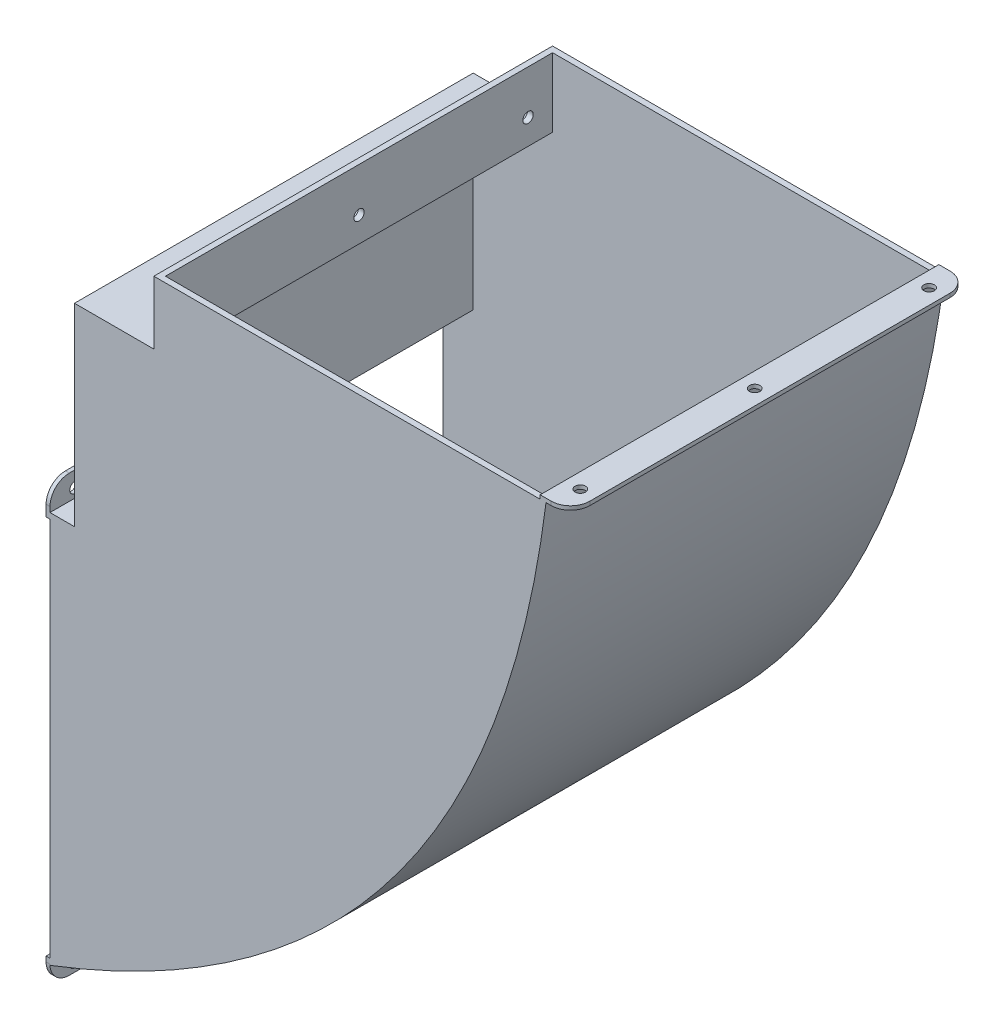
from build123d import *

# Parameters (mm, degrees)
BOSS_EXTRUDE3_DEPTH = 206.587093
SHELL1_T            = -3
BOSS_EXTRUDE4_DEPTH = 2
BOSS_EXTRUDE5_DEPTH = 2
SKETCH8_R           = 2.7
CUT_EXTRUDE2_DEPTH  = 3
SKETCH9_R           = 2.7
CUT_EXTRUDE3_DEPTH  = 2
SKETCH11_R          = 2.7
CUT_EXTRUDE4_DEPTH  = 2


with BuildPart() as part:
    # Sketch1 → Boss-Extrude3 (new body)
    with BuildSketch(Plane.XY):
        with BuildLine():
            Line((244.319092767, 234.634840909), (41.119092767, 234.634840909))
            Line((41.119092767, 234.634840909), (41.119092767, 201.934840909))
            Line((41.119092767, 201.934840909), (0, 201.934840909))
            Line((0, 201.934840909), (0, 101.672858907))
            Line((0, 101.672858907), (-12.7, 101.672858907))
            Line((-12.7, 101.672858907), (-12.7, -101.527141093))
            add(Edge.make_bspline(
                [(-12.7, -101.527141093), (212.797902698, -15.185130796), (244.319092767, 234.634840909)],
                knots=[0, 0, 0, 1, 1, 1], degree=2))
        make_face()
    extrude(amount=BOSS_EXTRUDE3_DEPTH)

    # Shell1
    shell1_openings = [part.faces().sort_by_distance(p)[0] for p in [
        (142.719092767, 234.634840909, 103.2935465),
        (-12.7, 0.072858907, 103.2935465),
    ]]
    offset(amount=SHELL1_T, openings=shell1_openings, kind=Kind.INTERSECTION)

    # Sketch4 → Boss-Extrude4 (add)
    with BuildSketch(Plane(origin=(0, 234.634840909, 0), x_dir=(1, 0, 0), z_dir=(0, 1, 0))):
        with BuildLine():
            Line((257.019092767, -10), (257.019092767, -196.587092864))
            ThreePointArc((257.019092767, -196.587092864), (254.090160579, -203.658160676), (247.019092767, -206.587092864))
            Line((247.019092767, -206.587092864), (244.319092767, -206.587092864))
            Line((244.319092767, -206.587092864), (241.295184716, -206.587092864))
            Line((241.295184716, -206.587092864), (241.295184716, 0))
            Line((241.295184716, 0), (247.019092767, 0))
            ThreePointArc((247.019092767, 0), (254.090160579, -2.928932188), (257.019092767, -10))
        make_face()
    extrude(amount=BOSS_EXTRUDE4_DEPTH)

    # Sketch5 → Boss-Extrude5 (add)
    with BuildSketch(Plane.ZY.offset(12.7)):
        with BuildLine():
            Line((10, 114.372858907), (196.587092864, 114.372858907))
            ThreePointArc((196.587092864, 114.372858907), (203.658160676, 111.443926719), (206.587092864, 104.372858907))
            Line((206.587092864, 104.372858907), (206.587092864, 98.672858907))
            Line((206.587092864, 98.672858907), (0, 98.672858907))
            Line((0, 98.672858907), (0, 104.372858907))
            ThreePointArc((0, 104.372858907), (2.928932188, 111.443926719), (10, 114.372858907))
        make_face()
        with BuildLine():
            Line((0, -98.313391167), (0, -101.013391167))
            ThreePointArc((0, -101.013391167), (2.928932188, -108.084458979), (10, -111.013391167))
            Line((10, -111.013391167), (196.587092864, -111.013391167))
            ThreePointArc((196.587092864, -111.013391167), (203.658160676, -108.084458979), (206.587092864, -101.013391167))
            Line((206.587092864, -101.013391167), (206.587092864, -98.313391167))
            Line((206.587092864, -98.313391167), (0, -98.313391167))
        make_face()
    extrude(amount=BOSS_EXTRUDE5_DEPTH)

    # Sketch8 → Cut-Extrude2 (cut)
    with BuildSketch(Plane(origin=(44.119092767, 0, 0), x_dir=(0, 0, -1), z_dir=(1, 0, 0))):
        with Locations(Location((-190.887092864, 211.934840909, 0), (0, 0, 90))):
            Circle(SKETCH8_R)
        with Locations(Location((-103.293546432, 211.934840909, 0), (0, 0, 90))):
            Circle(SKETCH8_R)
        with Locations(Location((-15.7, 211.934840909, 0), (0, 0, 90))):
            Circle(SKETCH8_R)
    extrude(amount=-CUT_EXTRUDE2_DEPTH, mode=Mode.SUBTRACT)

    # Sketch9 → Cut-Extrude3 (cut)
    with BuildSketch(Plane(origin=(0, 236.634840909, 0), x_dir=(1, 0, 0), z_dir=(0, 1, 0))):
        with Locations(Location((249.157138742, -12.931235523, 0), (0, 0, 180))):
            Circle(SKETCH9_R)
        with Locations(Location((249.157138742, -103.293546432, 0), (0, 0, 180))):
            Circle(SKETCH9_R)
        with Locations(Location((249.157138742, -193.655857341, 0), (0, 0, 180))):
            Circle(SKETCH9_R)
    extrude(amount=-CUT_EXTRUDE3_DEPTH, mode=Mode.SUBTRACT)

    # Sketch11 → Cut-Extrude4 (cut)
    with BuildSketch(Plane.ZY.offset(14.7)):
        with Locations(Location((12.933859514, 106.522858907, 0), (0, 0, 270))):
            Circle(SKETCH11_R)
        with Locations(Location((103.293546432, 106.522858907, 0), (0, 0, 270))):
            Circle(SKETCH11_R)
        with Locations(Location((193.653233351, 106.522858907, 0), (0, 0, 270))):
            Circle(SKETCH11_R)
        with Locations(Location((193.728321895, -106.386237609, 0), (0, 0, 270))):
            Circle(SKETCH11_R)
        with Locations(Location((103.368657455, -106.44997351, 0), (0, 0, 270))):
            Circle(SKETCH11_R)
        with Locations(Location((13.008993014, -106.51370941, 0), (0, 0, 270))):
            Circle(SKETCH11_R)
    extrude(amount=-CUT_EXTRUDE4_DEPTH, mode=Mode.SUBTRACT)


solid = part.part
